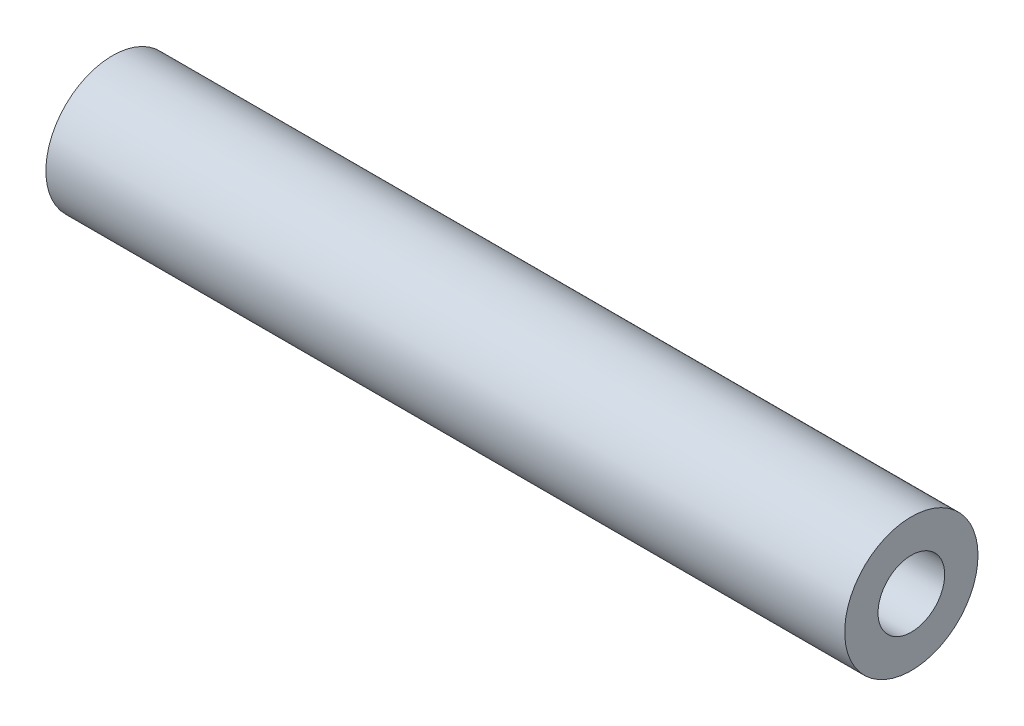
from build123d import *

# Parameters (mm, degrees)
SCHIZZO2_R                   = 2.5
SCHIZZO2_R_2                 = 1
ESTRUSIONE_ESTRUSIONE1_DEPTH = 14.98


with BuildPart() as part:
    # Schizzo2 → Estrusione-Estrusione1 (new, symmetric)
    with BuildSketch(Plane(origin=(0, 0, 0), x_dir=(0, 0, -1), z_dir=(1, 0, 0))):
        Circle(SCHIZZO2_R)
        Circle(SCHIZZO2_R_2, mode=Mode.SUBTRACT)
    extrude(amount=ESTRUSIONE_ESTRUSIONE1_DEPTH, both=True)

    # Schizzo5 → Foro filettato M3x0.5-2 (revolve, cut)
    with BuildSketch(Plane(origin=(14.98, 0, 0), x_dir=(0, 0, -1), z_dir=(0, 1, 0))):
        Polygon((0, 0), (0, 8.751075774), (1.25, 8), (1.25, 0), align=None)
    foro_filettato_m3x0_5_2 = revolve(axis=Axis((21.33, 0, 0), (-1, 0, 0)), mode=Mode.SUBTRACT)

    # Specchia1: Foro filettato M3x0.5-2 across plane
    add(foro_filettato_m3x0_5_2.mirror(Plane(origin=(0, 0, 0), x_dir=(0, 0, 1), z_dir=(1, 0, 0))), mode=Mode.SUBTRACT)


solid = part.part
